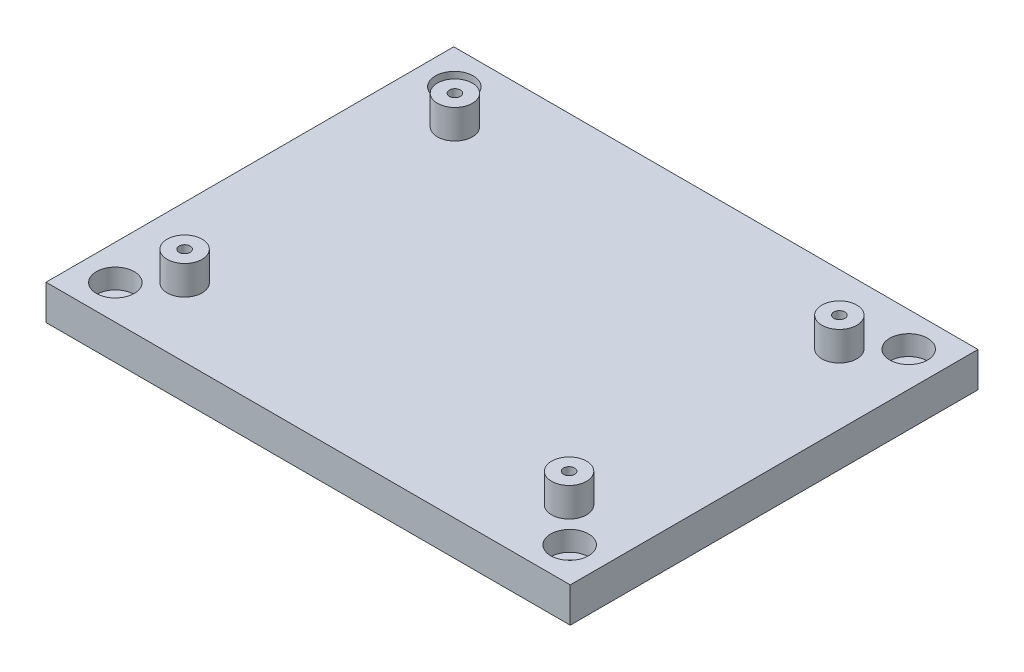
from build123d import *

# Parameters (mm, degrees)
SZKIC1_W                                            = 90
SZKIC1_H                                            = 70
DODANIE_WYCI_GNI_CIE1_DEPTH                         = 6
SZKIC2_R                                            = 3
SZKIC2_R_2                                          = 0.95
DODANIE_WYCI_GNI_CIE2_DEPTH                         = 5
CBORE_FOR_M3_HEX_SOCKET_HEAD_CAP_SCREW1_D           = 3.2
CBORE_FOR_M3_HEX_SOCKET_HEAD_CAP_SCREW1_DEPTH       = 17.7
CBORE_FOR_M3_HEX_SOCKET_HEAD_CAP_SCREW1_CBORE_D     = 6.5
CBORE_FOR_M3_HEX_SOCKET_HEAD_CAP_SCREW1_CBORE_DEPTH = 3.4
CBORE_FOR_M3_HEX_SOCKET_HEAD_CAP_SCREW1_TIP         = 0.96137699


with BuildPart() as part:
    # Szkic1 → Dodanie-wyciągnięcie1 (new body)
    with BuildSketch(Plane(origin=(0, 0, 0), x_dir=(1, 0, 0), z_dir=(0, 1, 0))):
        Rectangle(SZKIC1_W, SZKIC1_H)
    extrude(amount=DODANIE_WYCI_GNI_CIE1_DEPTH)

    # Szkic2 → Dodanie-wyciągnięcie2 (add)
    # profile 1 of 4: a face of its own
    with BuildSketch(Plane(origin=(0, 6, 0), x_dir=(1, 0, 0), z_dir=(0, 1, 0))):
        with Locations(Location((-33, 23.2, 0), (0, 0, 270))):
            Circle(SZKIC2_R)
        with Locations(Location((-33, 23.2, 0), (0, 0, 270))):
            Circle(SZKIC2_R_2, mode=Mode.SUBTRACT)
    # profile 2 of 4: a face of its own
    with BuildSketch(Plane(origin=(0, 6, 0), x_dir=(1, 0, 0), z_dir=(0, 1, 0))):
        with Locations(Location((-33, -23.2, 0), (0, 0, 270))):
            Circle(SZKIC2_R)
        with Locations(Location((-33, -23.2, 0), (0, 0, 270))):
            Circle(SZKIC2_R_2, mode=Mode.SUBTRACT)
    # profile 3 of 4: a face of its own
    with BuildSketch(Plane(origin=(0, 6, 0), x_dir=(1, 0, 0), z_dir=(0, 1, 0))):
        with Locations(Location((33, -23.2, 0), (0, 0, 270))):
            Circle(SZKIC2_R)
        with Locations(Location((33, -23.2, 0), (0, 0, 270))):
            Circle(SZKIC2_R_2, mode=Mode.SUBTRACT)
    # profile 4 of 4: a face of its own
    with BuildSketch(Plane(origin=(0, 6, 0), x_dir=(1, 0, 0), z_dir=(0, 1, 0))):
        with Locations(Location((33, 23.2, 0), (0, 0, 270))):
            Circle(SZKIC2_R)
        with Locations(Location((33, 23.2, 0), (0, 0, 270))):
            Circle(SZKIC2_R_2, mode=Mode.SUBTRACT)
    extrude(amount=DODANIE_WYCI_GNI_CIE2_DEPTH)

    # CBORE for M3 Hex Socket Head Cap Screw1
    with Locations(Plane(origin=(0, 6, 0), x_dir=(1, 0, 0), z_dir=(0, 1, 0))):
        with Locations((-39, 29.1), (-39, -29.1), (39, 29.1), (39, -29.1)):
            CounterBoreHole(CBORE_FOR_M3_HEX_SOCKET_HEAD_CAP_SCREW1_D / 2, CBORE_FOR_M3_HEX_SOCKET_HEAD_CAP_SCREW1_CBORE_D / 2, CBORE_FOR_M3_HEX_SOCKET_HEAD_CAP_SCREW1_CBORE_DEPTH, depth=CBORE_FOR_M3_HEX_SOCKET_HEAD_CAP_SCREW1_DEPTH)
            with Locations((0, 0, -(CBORE_FOR_M3_HEX_SOCKET_HEAD_CAP_SCREW1_DEPTH + CBORE_FOR_M3_HEX_SOCKET_HEAD_CAP_SCREW1_TIP / 2))):  # 118° drill point
                Cone(0, CBORE_FOR_M3_HEX_SOCKET_HEAD_CAP_SCREW1_D / 2, CBORE_FOR_M3_HEX_SOCKET_HEAD_CAP_SCREW1_TIP, mode=Mode.SUBTRACT)


solid = part.part
